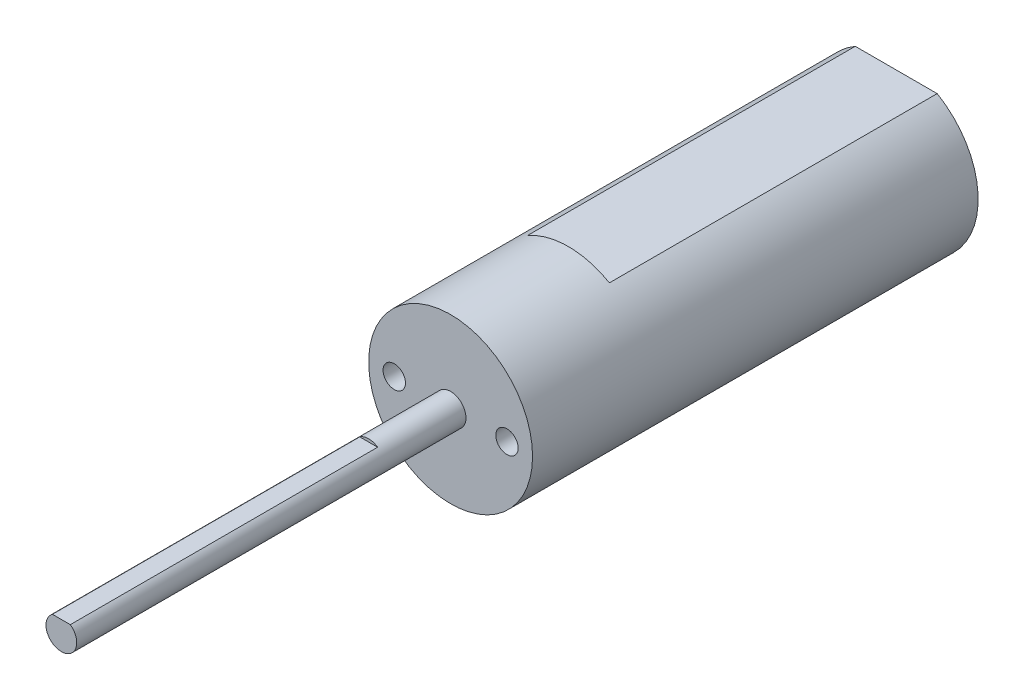
from build123d import *

# Parameters (mm, degrees)
SKETCH1_R           = 8
BOSS_EXTRUDE1_DEPTH = 32
CUT_EXTRUDE1_DEPTH  = 32
SKETCH4_R           = 8
BOSS_EXTRUDE2_DEPTH = 11.5
SKETCH5_R           = 1.0922
CUT_EXTRUDE2_DEPTH  = 6
SKETCH5_3_R         = 1.5
BOSS_EXTRUDE3_DEPTH = 38
CUT_EXTRUDE3_START  = -30
CUT_EXTRUDE3_DEPTH  = 30


with BuildPart() as part:
    # Sketch1 → Boss-Extrude1 (new body)
    with BuildSketch(Plane.XY):
        Circle(SKETCH1_R)
    extrude(amount=BOSS_EXTRUDE1_DEPTH)

    # Sketch3 → Cut-Extrude1 (cut)
    with BuildSketch(Plane(origin=(0, 0, 0), x_dir=(-1, 0, 0), z_dir=(0, 0, -1))):
        with BuildLine():
            ThreePointArc((4, 6.92820323), (0, 8), (-4, 6.92820323))
            Line((-4, 6.92820323), (4, 6.92820323))
        make_face()
        with BuildLine():
            Line((4, -6.92820323), (-4, -6.92820323))
            ThreePointArc((-4, -6.92820323), (0, -8), (4, -6.92820323))
        make_face()
    extrude(amount=-CUT_EXTRUDE1_DEPTH, mode=Mode.SUBTRACT)

    # Sketch4 → Boss-Extrude2 (add)
    with BuildSketch(Plane.XY.offset(32)):
        Circle(SKETCH4_R)
    extrude(amount=BOSS_EXTRUDE2_DEPTH)

    # Sketch5 → Cut-Extrude2 (cut)
    with BuildSketch(Plane.XY.offset(43.5)):
        with Locations((-5.5, 0)):
            Circle(SKETCH5_R)
        with Locations((5.5, 0)):
            Circle(SKETCH5_R)
    extrude(amount=-CUT_EXTRUDE2_DEPTH, mode=Mode.SUBTRACT)

    # Sketch5<3> → Boss-Extrude3 (add)
    with BuildSketch(Plane.XY.offset(43.5)):
        Circle(SKETCH5_3_R)
    extrude(amount=BOSS_EXTRUDE3_DEPTH)

    # Sketch6 → Cut-Extrude3 (cut)
    with BuildSketch(Plane.XY.offset(81.5).offset(CUT_EXTRUDE3_START)):
        with BuildLine():
            Line((-0.875, 1.218349293), (0.875, 1.218349293))
            ThreePointArc((0.875, 1.218349293), (0, 1.5), (-0.875, 1.218349293))
        make_face()
    extrude(amount=CUT_EXTRUDE3_DEPTH, mode=Mode.SUBTRACT)


solid = part.part
